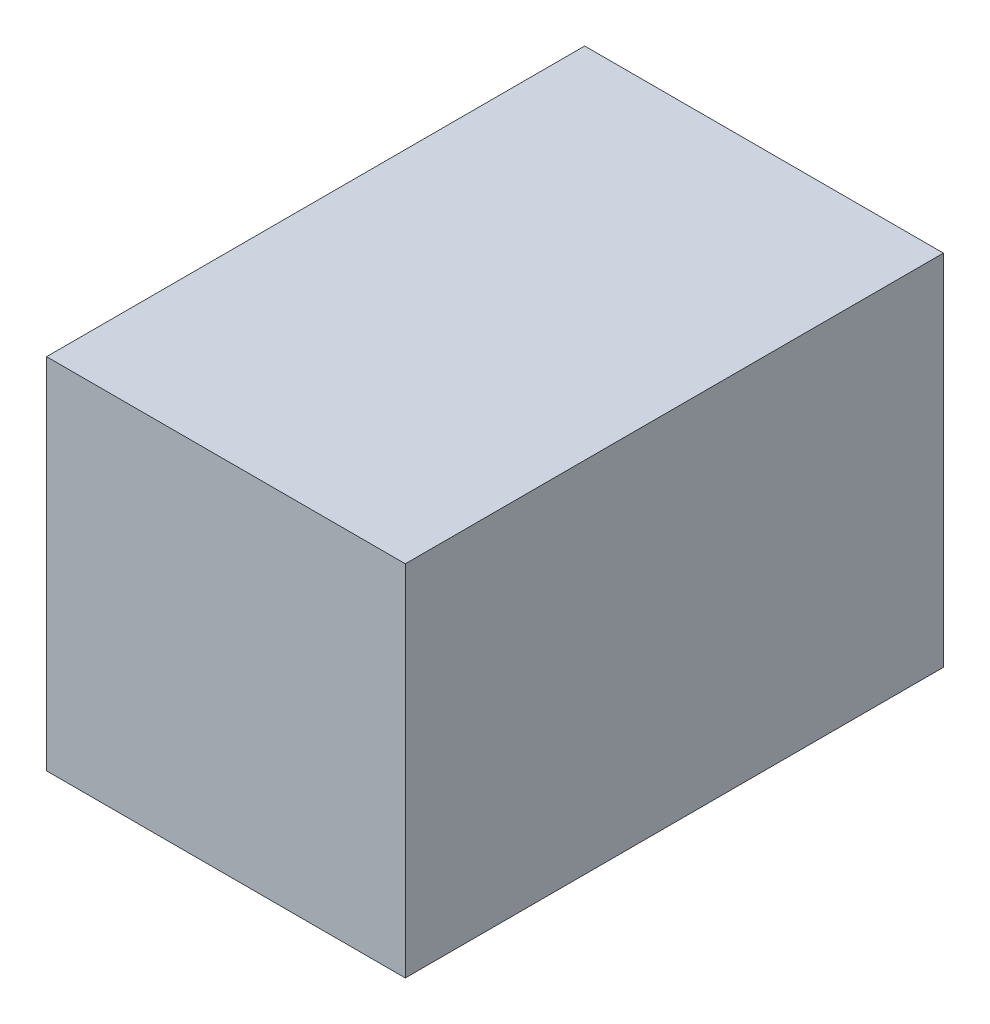
from build123d import *

# Parameters (mm, degrees)
SKETCH1_W           = 12.7
SKETCH1_H           = 19.05
BOSS_EXTRUDE1_DEPTH = 12.7


with BuildPart() as part:
    # Sketch1 → Boss-Extrude1 (new body)
    with BuildSketch(Plane(origin=(0, 0, 0), x_dir=(1, 0, 0), z_dir=(0, 1, 0))):
        Rectangle(SKETCH1_W, SKETCH1_H)
    extrude(amount=BOSS_EXTRUDE1_DEPTH)


solid = part.part
